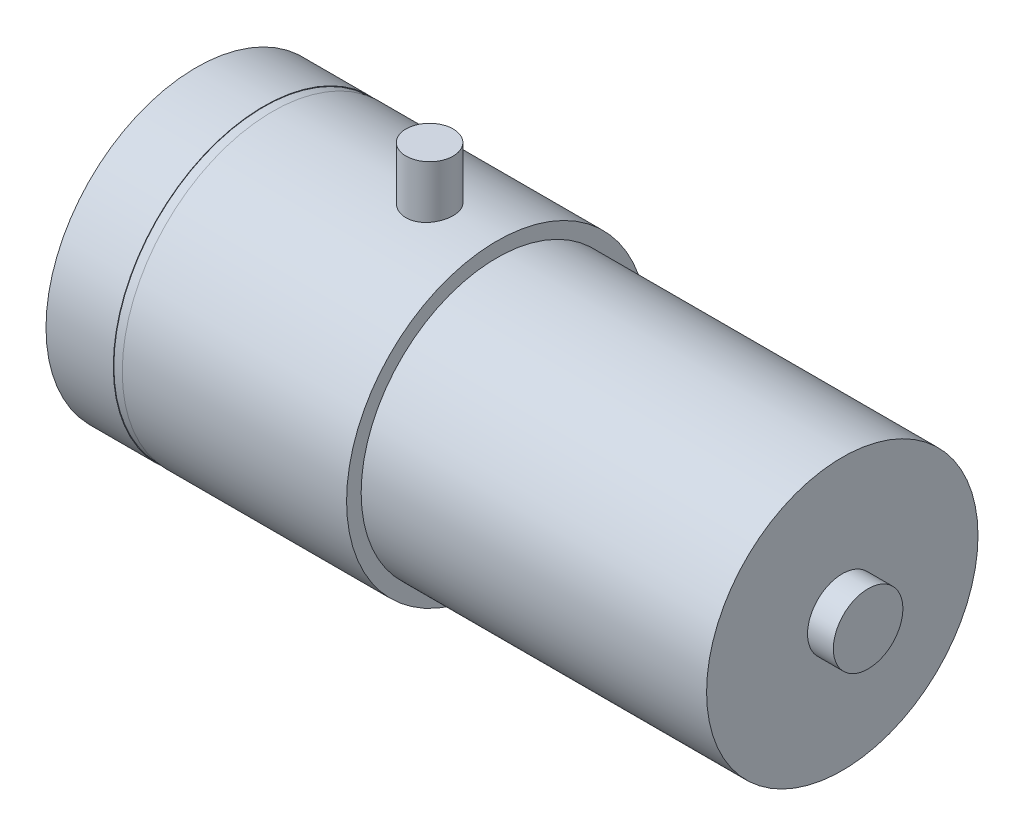
from build123d import *

# Parameters (mm, degrees)
ESQUISSE2_R             = 2.1
BOSS_EXTRU_1_DEPTH      = 18
ENL_V_START             = -6.8
ESQUISSE3_R             = 13.4
ESQUISSE3_R_2           = 13.35
ENL_V_MAT_EXTRU_1_DEPTH = 0.8


with BuildPart() as part:
    # Esquisse1 → Révolution1 (revolve)
    with BuildSketch(Plane.XY, mode=Mode.PRIVATE) as r_volution1_sk:
        Polygon((-33.6, 0), (-33.6, 2.15), (-26.8, 2.15), (-26.8, 13.4), (0, 13.4), (0, 12.1), (30.8, 12.1), (30.8, 3.1), (33.1, 3.1), (33.1, 0), align=None)
    revolve(r_volution1_sk.sketch.rotate(Axis((0, 0, 0), (1, 0, 0)), 90), axis=Axis((0, 0, 0), (1, 0, 0)))

    # Esquisse2 → Boss.-Extru.1 (add)
    with BuildSketch(Plane(origin=(0, 0, 0), x_dir=(1, 0, 0), z_dir=(0, 1, 0))):
        with Locations(Location((-6, 0, 0), (0, 0, 90))):
            Circle(ESQUISSE2_R)
    extrude(amount=BOSS_EXTRU_1_DEPTH)

    # Esquisse3 → Enlèv. mat.-Extru.1 (cut)
    with BuildSketch(Plane.ZY.offset(26.8).offset(ENL_V_START)):
        Circle(ESQUISSE3_R)
        Circle(ESQUISSE3_R_2, mode=Mode.SUBTRACT)
    extrude(amount=ENL_V_MAT_EXTRU_1_DEPTH, mode=Mode.SUBTRACT)


solid = part.part
